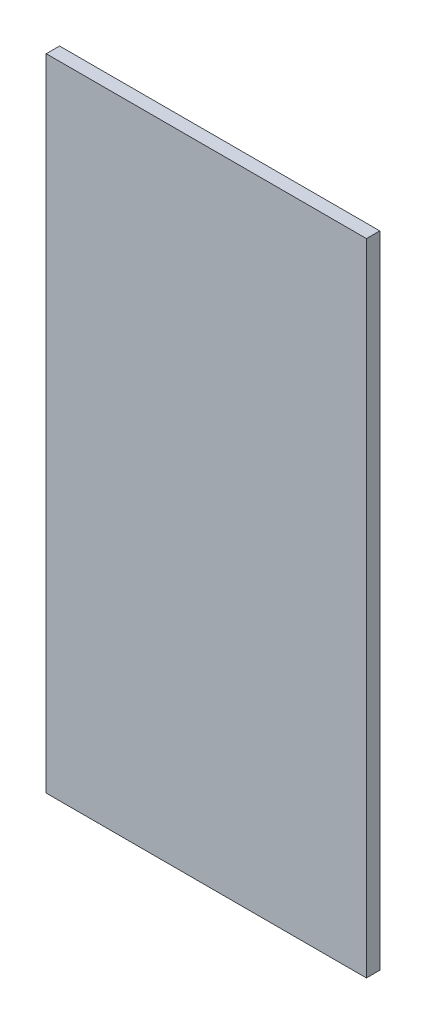
from build123d import *

# Parameters (mm, degrees)
SKETCH1_W           = 1219.2
SKETCH1_H           = 2438.4
BOSS_EXTRUDE1_DEPTH = 50.8


with BuildPart() as part:
    # Sketch1 → Boss-Extrude1 (new body)
    with BuildSketch(Plane.XY):
        with Locations((609.6, 1219.2)):
            Rectangle(SKETCH1_W, SKETCH1_H)
    extrude(amount=-BOSS_EXTRUDE1_DEPTH)


solid = part.part
